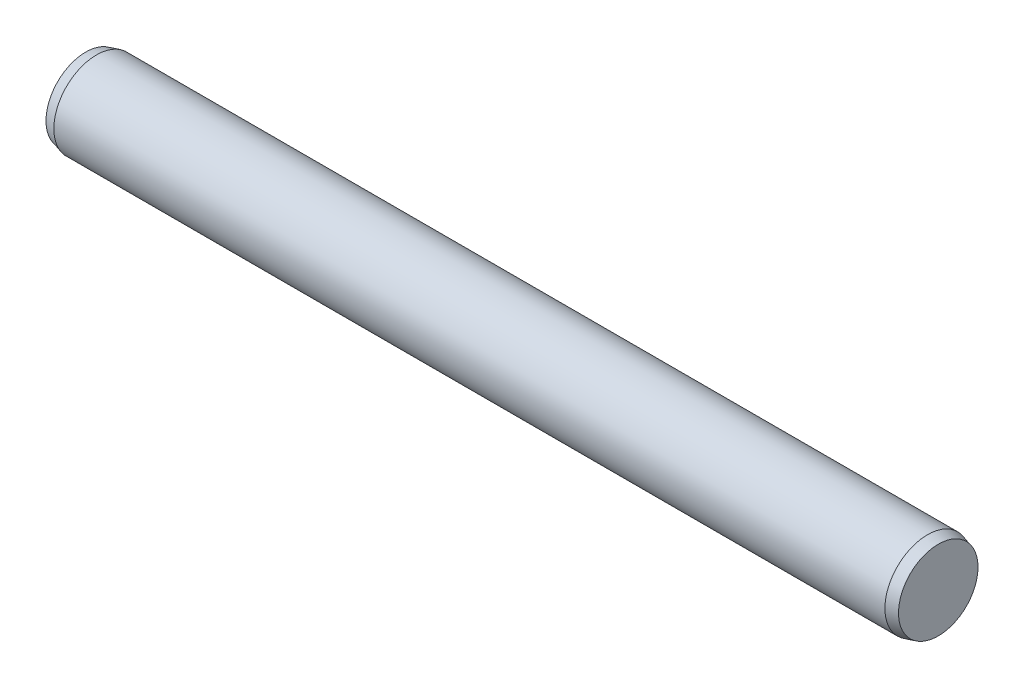
from build123d import *

# Parameters (mm, degrees)
EXTRUDE1_DEPTH      = 24.37
EXTRUDE1_DEPTH_BACK = 24.37
SKETCH2_R           = 2.5
SKETCH3_R           = 2.5
EXTRUDE2_DEPTH      = 0.63
EXTRUDE2_TAPER      = 15
SKETCH4_R           = 2.5
EXTRUDE3_DEPTH      = 0.63
EXTRUDE3_TAPER      = 15


with BuildPart() as part:
    # Sketch2 → Extrude1 (new, two sides: drawn at the far end of the back side and taken through both)
    with BuildSketch(Plane(origin=(0, 0, 0), x_dir=(0, 0, -1), z_dir=(1, 0, 0)).offset(-EXTRUDE1_DEPTH_BACK)):
        Circle(SKETCH2_R)
    extrude(amount=EXTRUDE1_DEPTH + EXTRUDE1_DEPTH_BACK)

    # Sketch3 → Extrude2 (add)
    with BuildSketch(Plane(origin=(24.37, 0, 0), x_dir=(0, 0, -1), z_dir=(1, 0, 0))):
        Circle(SKETCH3_R)
    extrude(amount=EXTRUDE2_DEPTH, taper=EXTRUDE2_TAPER)

    # Sketch4 → Extrude3 (add)
    with BuildSketch(Plane.ZY.offset(24.37)):
        with Locations(Location((0, 0, 0), (0, 0, 180))):
            Circle(SKETCH4_R)
    extrude(amount=EXTRUDE3_DEPTH, taper=EXTRUDE3_TAPER)


solid = part.part
